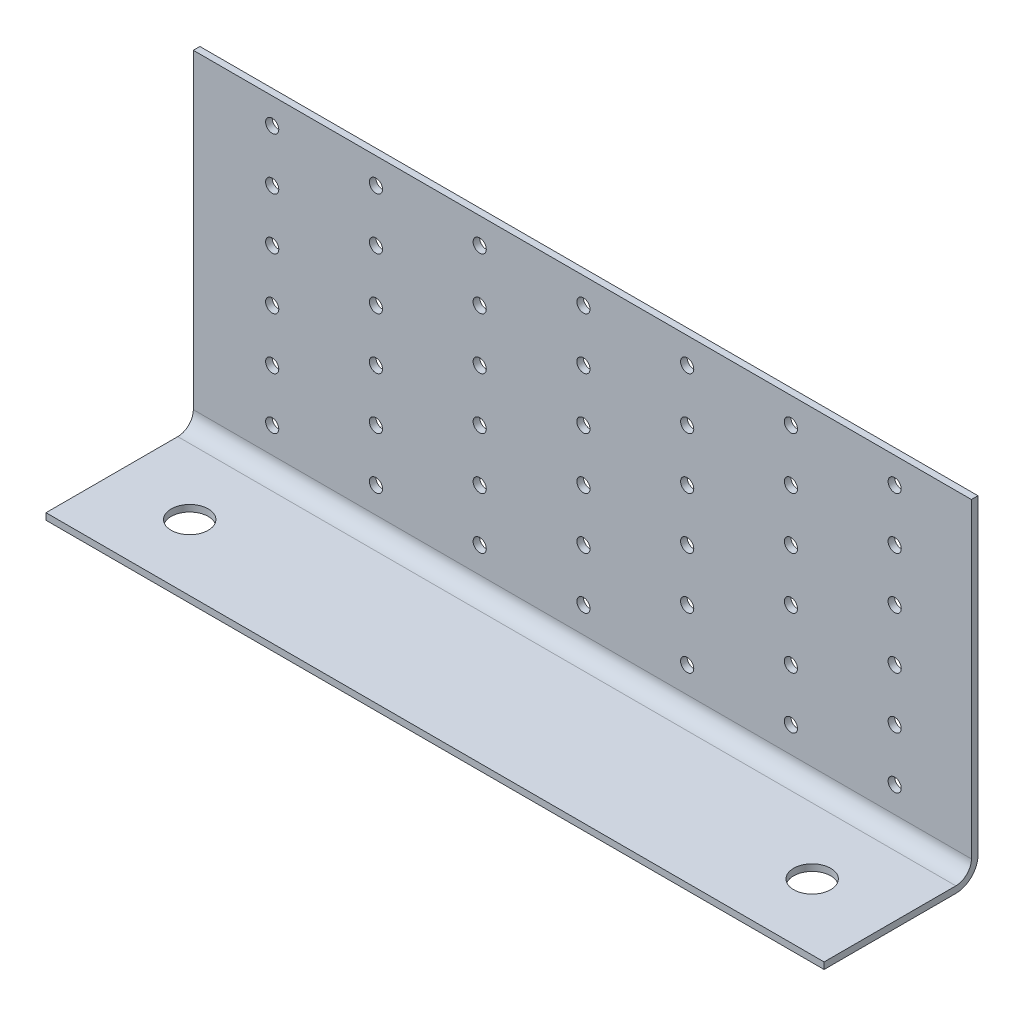
from build123d import *

# Parameters (mm, degrees)
EXTRUDE_THIN1_DEPTH        = 150
SKETCH5_R                  = 3.575
CUT_EXTRUDE1_DEPTH         = 165.651961158
SKETCH6_R                  = 1.27
CUT_EXTRUDE2_DEPTH         = 158.844076918
LPATTERN2_COUNT            = 7
LPATTERN2_PITCH            = 20
LPATTERN3_COUNT            = 6
LPATTERN3_PITCH            = 10
LPATTERN3_COPY_1_SKETCH_R  = 1.27
LPATTERN3_COPY_1_DEPTH     = 158.844076918
LPATTERN3_COPY_2_SKETCH_R  = 1.27
LPATTERN3_COPY_2_DEPTH     = 158.844076918
LPATTERN3_COPY_3_SKETCH_R  = 1.27
LPATTERN3_COPY_3_DEPTH     = 158.844076918
LPATTERN3_COPY_4_SKETCH_R  = 1.27
LPATTERN3_COPY_4_DEPTH     = 158.844076918
LPATTERN3_COPY_5_SKETCH_R  = 1.27
LPATTERN3_COPY_5_DEPTH     = 158.844076918
LPATTERN3_COPY_6_SKETCH_R  = 1.27
LPATTERN3_COPY_6_DEPTH     = 158.844076918
LPATTERN3_COPY_7_SKETCH_R  = 1.27
LPATTERN3_COPY_7_DEPTH     = 158.844076918
LPATTERN3_COPY_8_SKETCH_R  = 1.27
LPATTERN3_COPY_8_DEPTH     = 158.844076918
LPATTERN3_COPY_9_SKETCH_R  = 1.27
LPATTERN3_COPY_9_DEPTH     = 158.844076918
LPATTERN3_COPY_10_SKETCH_R = 1.27
LPATTERN3_COPY_10_DEPTH    = 158.844076918
LPATTERN3_COPY_11_SKETCH_R = 1.27
LPATTERN3_COPY_11_DEPTH    = 158.844076918
LPATTERN3_COPY_12_SKETCH_R = 1.27
LPATTERN3_COPY_12_DEPTH    = 158.844076918
LPATTERN3_COPY_13_SKETCH_R = 1.27
LPATTERN3_COPY_13_DEPTH    = 158.844076918
LPATTERN3_COPY_14_SKETCH_R = 1.27
LPATTERN3_COPY_14_DEPTH    = 158.844076918
LPATTERN3_COPY_15_SKETCH_R = 1.27
LPATTERN3_COPY_15_DEPTH    = 158.844076918
LPATTERN3_COPY_16_SKETCH_R = 1.27
LPATTERN3_COPY_16_DEPTH    = 158.844076918
LPATTERN3_COPY_17_SKETCH_R = 1.27
LPATTERN3_COPY_17_DEPTH    = 158.844076918
LPATTERN3_COPY_18_SKETCH_R = 1.27
LPATTERN3_COPY_18_DEPTH    = 158.844076918
LPATTERN3_COPY_19_SKETCH_R = 1.27
LPATTERN3_COPY_19_DEPTH    = 158.844076918
LPATTERN3_COPY_20_SKETCH_R = 1.27
LPATTERN3_COPY_20_DEPTH    = 158.844076918
LPATTERN3_COPY_21_SKETCH_R = 1.27
LPATTERN3_COPY_21_DEPTH    = 158.844076918
LPATTERN3_COPY_22_SKETCH_R = 1.27
LPATTERN3_COPY_22_DEPTH    = 158.844076918
LPATTERN3_COPY_23_SKETCH_R = 1.27
LPATTERN3_COPY_23_DEPTH    = 158.844076918
LPATTERN3_COPY_24_SKETCH_R = 1.27
LPATTERN3_COPY_24_DEPTH    = 158.844076918
LPATTERN3_COPY_25_SKETCH_R = 1.27
LPATTERN3_COPY_25_DEPTH    = 158.844076918
LPATTERN3_COPY_26_SKETCH_R = 1.27
LPATTERN3_COPY_26_DEPTH    = 158.844076918
LPATTERN3_COPY_27_SKETCH_R = 1.27
LPATTERN3_COPY_27_DEPTH    = 158.844076918
LPATTERN3_COPY_28_SKETCH_R = 1.27
LPATTERN3_COPY_28_DEPTH    = 158.844076918
LPATTERN3_COPY_29_SKETCH_R = 1.27
LPATTERN3_COPY_29_DEPTH    = 158.844076918
LPATTERN3_COPY_30_SKETCH_R = 1.27
LPATTERN3_COPY_30_DEPTH    = 158.844076918


with BuildPart() as part:
    # Sketch2 → Extrude-Thin1 (new body)
    with BuildSketch(Plane(origin=(0, 0, 0), x_dir=(0, 0, -1), z_dir=(1, 0, 0))):
        with BuildLine():
            Line((-25.323276114, -22.897723031), (0.076723886, -22.897723031))
            ThreePointArc((0.076723886, -22.897723031), (2.198044229, -22.019043375), (3.076723886, -19.897723031))
            Line((3.076723886, -19.897723031), (3.076723886, 40.102276969))
            Line((3.076723886, 40.102276969), (4.346723886, 40.102276969))
            Line((4.346723886, 40.102276969), (4.346723886, -19.897723031))
            ThreePointArc((4.346723886, -19.897723031), (3.096069841, -22.917068987), (0.076723886, -24.167723031))
            Line((0.076723886, -24.167723031), (-25.323276114, -24.167723031))
            Line((-25.323276114, -24.167723031), (-25.323276114, -22.897723031))
        make_face()
    extrude(amount=EXTRUDE_THIN1_DEPTH)

    # Sketch5 → Cut-Extrude1 (cut, through all)
    with BuildSketch(Plane(origin=(0, -22.897723031, 0), x_dir=(1, 0, 0), z_dir=(0, 1, 0))):
        with Locations(Location((15, -12.623276114, 0), (0, 0, 270))):
            Circle(SKETCH5_R)
        with Locations(Location((135, -12.623276114, 0), (0, 0, 270))):
            Circle(SKETCH5_R)
    extrude(amount=-CUT_EXTRUDE1_DEPTH, mode=Mode.SUBTRACT)

    # Sketch6 → Cut-Extrude2 (cut, through all)
    with BuildSketch(Plane.XY.offset(-3.076723886)):
        with Locations((15.205434806, 35.102276969)):
            Circle(SKETCH6_R)
    cut_extrude2 = extrude(amount=-CUT_EXTRUDE2_DEPTH, mode=Mode.SUBTRACT)

    # LPattern2: Cut-Extrude2 ×7
    with Locations(*[(i * LPATTERN2_PITCH, 0, 0) for i in range(1, LPATTERN2_COUNT)]):
        add(cut_extrude2, mode=Mode.SUBTRACT)

    # LPattern3: Cut-Extrude2 ×6
    with Locations(*[(0, -i * LPATTERN3_PITCH, 0) for i in range(1, LPATTERN3_COUNT)]):
        add(cut_extrude2, mode=Mode.SUBTRACT)

    # LPattern3 copy 1 sketch → LPattern3 copy 1 (cut, through all)
    with BuildSketch(Plane(origin=(20, -10, -3.076723886), x_dir=(1, 0, 0), z_dir=(0, 0, 1))):
        with Locations((15.205434806, 35.102276969)):
            Circle(LPATTERN3_COPY_1_SKETCH_R)
    extrude(amount=-LPATTERN3_COPY_1_DEPTH, mode=Mode.SUBTRACT)

    # LPattern3 copy 2 sketch → LPattern3 copy 2 (cut, through all)
    with BuildSketch(Plane(origin=(20, -20, -3.076723886), x_dir=(1, 0, 0), z_dir=(0, 0, 1))):
        with Locations((15.205434806, 35.102276969)):
            Circle(LPATTERN3_COPY_2_SKETCH_R)
    extrude(amount=-LPATTERN3_COPY_2_DEPTH, mode=Mode.SUBTRACT)

    # LPattern3 copy 3 sketch → LPattern3 copy 3 (cut, through all)
    with BuildSketch(Plane(origin=(20, -30, -3.076723886), x_dir=(1, 0, 0), z_dir=(0, 0, 1))):
        with Locations((15.205434806, 35.102276969)):
            Circle(LPATTERN3_COPY_3_SKETCH_R)
    extrude(amount=-LPATTERN3_COPY_3_DEPTH, mode=Mode.SUBTRACT)

    # LPattern3 copy 4 sketch → LPattern3 copy 4 (cut, through all)
    with BuildSketch(Plane(origin=(20, -40, -3.076723886), x_dir=(1, 0, 0), z_dir=(0, 0, 1))):
        with Locations((15.205434806, 35.102276969)):
            Circle(LPATTERN3_COPY_4_SKETCH_R)
    extrude(amount=-LPATTERN3_COPY_4_DEPTH, mode=Mode.SUBTRACT)

    # LPattern3 copy 5 sketch → LPattern3 copy 5 (cut, through all)
    with BuildSketch(Plane(origin=(20, -50, -3.076723886), x_dir=(1, 0, 0), z_dir=(0, 0, 1))):
        with Locations((15.205434806, 35.102276969)):
            Circle(LPATTERN3_COPY_5_SKETCH_R)
    extrude(amount=-LPATTERN3_COPY_5_DEPTH, mode=Mode.SUBTRACT)

    # LPattern3 copy 6 sketch → LPattern3 copy 6 (cut, through all)
    with BuildSketch(Plane(origin=(40, -10, -3.076723886), x_dir=(1, 0, 0), z_dir=(0, 0, 1))):
        with Locations((15.205434806, 35.102276969)):
            Circle(LPATTERN3_COPY_6_SKETCH_R)
    extrude(amount=-LPATTERN3_COPY_6_DEPTH, mode=Mode.SUBTRACT)

    # LPattern3 copy 7 sketch → LPattern3 copy 7 (cut, through all)
    with BuildSketch(Plane(origin=(40, -20, -3.076723886), x_dir=(1, 0, 0), z_dir=(0, 0, 1))):
        with Locations((15.205434806, 35.102276969)):
            Circle(LPATTERN3_COPY_7_SKETCH_R)
    extrude(amount=-LPATTERN3_COPY_7_DEPTH, mode=Mode.SUBTRACT)

    # LPattern3 copy 8 sketch → LPattern3 copy 8 (cut, through all)
    with BuildSketch(Plane(origin=(40, -30, -3.076723886), x_dir=(1, 0, 0), z_dir=(0, 0, 1))):
        with Locations((15.205434806, 35.102276969)):
            Circle(LPATTERN3_COPY_8_SKETCH_R)
    extrude(amount=-LPATTERN3_COPY_8_DEPTH, mode=Mode.SUBTRACT)

    # LPattern3 copy 9 sketch → LPattern3 copy 9 (cut, through all)
    with BuildSketch(Plane(origin=(40, -40, -3.076723886), x_dir=(1, 0, 0), z_dir=(0, 0, 1))):
        with Locations((15.205434806, 35.102276969)):
            Circle(LPATTERN3_COPY_9_SKETCH_R)
    extrude(amount=-LPATTERN3_COPY_9_DEPTH, mode=Mode.SUBTRACT)

    # LPattern3 copy 10 sketch → LPattern3 copy 10 (cut, through all)
    with BuildSketch(Plane(origin=(40, -50, -3.076723886), x_dir=(1, 0, 0), z_dir=(0, 0, 1))):
        with Locations((15.205434806, 35.102276969)):
            Circle(LPATTERN3_COPY_10_SKETCH_R)
    extrude(amount=-LPATTERN3_COPY_10_DEPTH, mode=Mode.SUBTRACT)

    # LPattern3 copy 11 sketch → LPattern3 copy 11 (cut, through all)
    with BuildSketch(Plane(origin=(60, -10, -3.076723886), x_dir=(1, 0, 0), z_dir=(0, 0, 1))):
        with Locations((15.205434806, 35.102276969)):
            Circle(LPATTERN3_COPY_11_SKETCH_R)
    extrude(amount=-LPATTERN3_COPY_11_DEPTH, mode=Mode.SUBTRACT)

    # LPattern3 copy 12 sketch → LPattern3 copy 12 (cut, through all)
    with BuildSketch(Plane(origin=(60, -20, -3.076723886), x_dir=(1, 0, 0), z_dir=(0, 0, 1))):
        with Locations((15.205434806, 35.102276969)):
            Circle(LPATTERN3_COPY_12_SKETCH_R)
    extrude(amount=-LPATTERN3_COPY_12_DEPTH, mode=Mode.SUBTRACT)

    # LPattern3 copy 13 sketch → LPattern3 copy 13 (cut, through all)
    with BuildSketch(Plane(origin=(60, -30, -3.076723886), x_dir=(1, 0, 0), z_dir=(0, 0, 1))):
        with Locations((15.205434806, 35.102276969)):
            Circle(LPATTERN3_COPY_13_SKETCH_R)
    extrude(amount=-LPATTERN3_COPY_13_DEPTH, mode=Mode.SUBTRACT)

    # LPattern3 copy 14 sketch → LPattern3 copy 14 (cut, through all)
    with BuildSketch(Plane(origin=(60, -40, -3.076723886), x_dir=(1, 0, 0), z_dir=(0, 0, 1))):
        with Locations((15.205434806, 35.102276969)):
            Circle(LPATTERN3_COPY_14_SKETCH_R)
    extrude(amount=-LPATTERN3_COPY_14_DEPTH, mode=Mode.SUBTRACT)

    # LPattern3 copy 15 sketch → LPattern3 copy 15 (cut, through all)
    with BuildSketch(Plane(origin=(60, -50, -3.076723886), x_dir=(1, 0, 0), z_dir=(0, 0, 1))):
        with Locations((15.205434806, 35.102276969)):
            Circle(LPATTERN3_COPY_15_SKETCH_R)
    extrude(amount=-LPATTERN3_COPY_15_DEPTH, mode=Mode.SUBTRACT)

    # LPattern3 copy 16 sketch → LPattern3 copy 16 (cut, through all)
    with BuildSketch(Plane(origin=(80, -10, -3.076723886), x_dir=(1, 0, 0), z_dir=(0, 0, 1))):
        with Locations((15.205434806, 35.102276969)):
            Circle(LPATTERN3_COPY_16_SKETCH_R)
    extrude(amount=-LPATTERN3_COPY_16_DEPTH, mode=Mode.SUBTRACT)

    # LPattern3 copy 17 sketch → LPattern3 copy 17 (cut, through all)
    with BuildSketch(Plane(origin=(80, -20, -3.076723886), x_dir=(1, 0, 0), z_dir=(0, 0, 1))):
        with Locations((15.205434806, 35.102276969)):
            Circle(LPATTERN3_COPY_17_SKETCH_R)
    extrude(amount=-LPATTERN3_COPY_17_DEPTH, mode=Mode.SUBTRACT)

    # LPattern3 copy 18 sketch → LPattern3 copy 18 (cut, through all)
    with BuildSketch(Plane(origin=(80, -30, -3.076723886), x_dir=(1, 0, 0), z_dir=(0, 0, 1))):
        with Locations((15.205434806, 35.102276969)):
            Circle(LPATTERN3_COPY_18_SKETCH_R)
    extrude(amount=-LPATTERN3_COPY_18_DEPTH, mode=Mode.SUBTRACT)

    # LPattern3 copy 19 sketch → LPattern3 copy 19 (cut, through all)
    with BuildSketch(Plane(origin=(80, -40, -3.076723886), x_dir=(1, 0, 0), z_dir=(0, 0, 1))):
        with Locations((15.205434806, 35.102276969)):
            Circle(LPATTERN3_COPY_19_SKETCH_R)
    extrude(amount=-LPATTERN3_COPY_19_DEPTH, mode=Mode.SUBTRACT)

    # LPattern3 copy 20 sketch → LPattern3 copy 20 (cut, through all)
    with BuildSketch(Plane(origin=(80, -50, -3.076723886), x_dir=(1, 0, 0), z_dir=(0, 0, 1))):
        with Locations((15.205434806, 35.102276969)):
            Circle(LPATTERN3_COPY_20_SKETCH_R)
    extrude(amount=-LPATTERN3_COPY_20_DEPTH, mode=Mode.SUBTRACT)

    # LPattern3 copy 21 sketch → LPattern3 copy 21 (cut, through all)
    with BuildSketch(Plane(origin=(100, -10, -3.076723886), x_dir=(1, 0, 0), z_dir=(0, 0, 1))):
        with Locations((15.205434806, 35.102276969)):
            Circle(LPATTERN3_COPY_21_SKETCH_R)
    extrude(amount=-LPATTERN3_COPY_21_DEPTH, mode=Mode.SUBTRACT)

    # LPattern3 copy 22 sketch → LPattern3 copy 22 (cut, through all)
    with BuildSketch(Plane(origin=(100, -20, -3.076723886), x_dir=(1, 0, 0), z_dir=(0, 0, 1))):
        with Locations((15.205434806, 35.102276969)):
            Circle(LPATTERN3_COPY_22_SKETCH_R)
    extrude(amount=-LPATTERN3_COPY_22_DEPTH, mode=Mode.SUBTRACT)

    # LPattern3 copy 23 sketch → LPattern3 copy 23 (cut, through all)
    with BuildSketch(Plane(origin=(100, -30, -3.076723886), x_dir=(1, 0, 0), z_dir=(0, 0, 1))):
        with Locations((15.205434806, 35.102276969)):
            Circle(LPATTERN3_COPY_23_SKETCH_R)
    extrude(amount=-LPATTERN3_COPY_23_DEPTH, mode=Mode.SUBTRACT)

    # LPattern3 copy 24 sketch → LPattern3 copy 24 (cut, through all)
    with BuildSketch(Plane(origin=(100, -40, -3.076723886), x_dir=(1, 0, 0), z_dir=(0, 0, 1))):
        with Locations((15.205434806, 35.102276969)):
            Circle(LPATTERN3_COPY_24_SKETCH_R)
    extrude(amount=-LPATTERN3_COPY_24_DEPTH, mode=Mode.SUBTRACT)

    # LPattern3 copy 25 sketch → LPattern3 copy 25 (cut, through all)
    with BuildSketch(Plane(origin=(100, -50, -3.076723886), x_dir=(1, 0, 0), z_dir=(0, 0, 1))):
        with Locations((15.205434806, 35.102276969)):
            Circle(LPATTERN3_COPY_25_SKETCH_R)
    extrude(amount=-LPATTERN3_COPY_25_DEPTH, mode=Mode.SUBTRACT)

    # LPattern3 copy 26 sketch → LPattern3 copy 26 (cut, through all)
    with BuildSketch(Plane(origin=(120, -10, -3.076723886), x_dir=(1, 0, 0), z_dir=(0, 0, 1))):
        with Locations((15.205434806, 35.102276969)):
            Circle(LPATTERN3_COPY_26_SKETCH_R)
    extrude(amount=-LPATTERN3_COPY_26_DEPTH, mode=Mode.SUBTRACT)

    # LPattern3 copy 27 sketch → LPattern3 copy 27 (cut, through all)
    with BuildSketch(Plane(origin=(120, -20, -3.076723886), x_dir=(1, 0, 0), z_dir=(0, 0, 1))):
        with Locations((15.205434806, 35.102276969)):
            Circle(LPATTERN3_COPY_27_SKETCH_R)
    extrude(amount=-LPATTERN3_COPY_27_DEPTH, mode=Mode.SUBTRACT)

    # LPattern3 copy 28 sketch → LPattern3 copy 28 (cut, through all)
    with BuildSketch(Plane(origin=(120, -30, -3.076723886), x_dir=(1, 0, 0), z_dir=(0, 0, 1))):
        with Locations((15.205434806, 35.102276969)):
            Circle(LPATTERN3_COPY_28_SKETCH_R)
    extrude(amount=-LPATTERN3_COPY_28_DEPTH, mode=Mode.SUBTRACT)

    # LPattern3 copy 29 sketch → LPattern3 copy 29 (cut, through all)
    with BuildSketch(Plane(origin=(120, -40, -3.076723886), x_dir=(1, 0, 0), z_dir=(0, 0, 1))):
        with Locations((15.205434806, 35.102276969)):
            Circle(LPATTERN3_COPY_29_SKETCH_R)
    extrude(amount=-LPATTERN3_COPY_29_DEPTH, mode=Mode.SUBTRACT)

    # LPattern3 copy 30 sketch → LPattern3 copy 30 (cut, through all)
    with BuildSketch(Plane(origin=(120, -50, -3.076723886), x_dir=(1, 0, 0), z_dir=(0, 0, 1))):
        with Locations((15.205434806, 35.102276969)):
            Circle(LPATTERN3_COPY_30_SKETCH_R)
    extrude(amount=-LPATTERN3_COPY_30_DEPTH, mode=Mode.SUBTRACT)


solid = part.part
